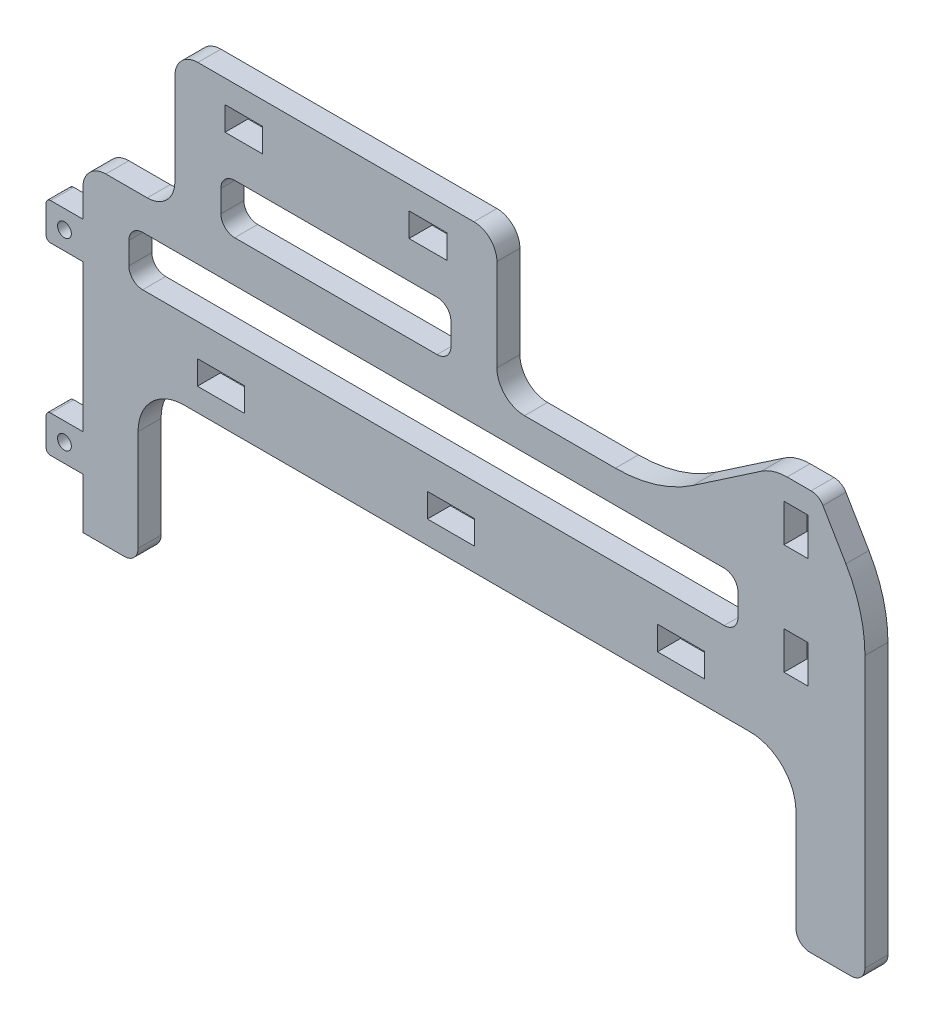
from build123d import *

# Parameters (mm, degrees)
SALIENTE_EXTRUIR1_DEPTH = 5
CROQUIS2_W              = 143
CROQUIS2_H              = 35
CORTAR_EXTRUIR1_DEPTH   = 5
REDONDEO1_R             = 10
CROQUIS3_W              = 5
CROQUIS3_H              = 8
SALIENTE_EXTRUIR2_DEPTH = 8
REDONDEO2_R             = 30
REDONDEO3_R             = 3
CROQUIS4_W              = 5.2
CROQUIS4_H              = 8.2
CORTAR_EXTRUIR2_DEPTH   = 192.034028382
REDONDEO4_R             = 3
REDONDEO5_R             = 10
REDONDEO6_R             = 1
CROQUIS5_R              = 1.5
CORTAR_EXTRUIR3_DEPTH   = 5
CROQUIS6_W              = 10.2
CROQUIS6_H              = 5.2
CORTAR_EXTRUIR4_DEPTH   = 5
CROQUIS7_W              = 132.4
CROQUIS7_H              = 10.8
CORTAR_EXTRUIR5_DEPTH   = 5
REDONDEO8_R             = 3
CROQUIS8_W              = 70
CROQUIS8_H              = 31
SALIENTE_EXTRUIR3_DEPTH = 5
CROQUIS9_W              = 8.2
CROQUIS9_H              = 5.2
CORTAR_EXTRUIR6_DEPTH   = 5
CROQUIS10_W             = 50
CROQUIS10_H             = 10.8
CORTAR_EXTRUIR7_DEPTH   = 5
REDONDEO9_R             = 3
REDONDEO10_R            = 6
REDONDEO11_R            = 5
REDONDEO12_R            = 5


with BuildPart() as part:
    # Croquis1 → Saliente-Extruir1 (new body)
    with BuildSketch(Plane.XY):
        Polygon((0, 0), (0, 70), (125, 70), (150, 87), (160, 87), (170, 70), (170, 0), align=None)
    extrude(amount=SALIENTE_EXTRUIR1_DEPTH)

    # Croquis2 → Cortar-Extruir1 (cut)
    with BuildSketch(Plane.XY.offset(5)):
        with Locations((83.5, 17.5)):
            Rectangle(CROQUIS2_W, CROQUIS2_H)
    extrude(amount=-CORTAR_EXTRUIR1_DEPTH, mode=Mode.SUBTRACT)

    # Redondeo1
    redondeo1_edges = [part.edges().sort_by_distance(p)[0] for p in [
        (12, 35, 2.5),
        (155, 35, 2.5),
    ]]
    fillet(redondeo1_edges, radius=REDONDEO1_R)

    # Croquis3 → Saliente-Extruir2 (add)
    with BuildSketch(Plane.ZY):
        with Locations((2.5, 15)):
            Rectangle(CROQUIS3_W, CROQUIS3_H)
        with Locations((2.5, 55)):
            Rectangle(CROQUIS3_W, CROQUIS3_H)
    extrude(amount=SALIENTE_EXTRUIR2_DEPTH)

    # Redondeo2
    redondeo2_edges = [part.edges().sort_by_distance(p)[0] for p in [
        (125, 70, 2.5),
        (170, 70, 2.5),
    ]]
    fillet(redondeo2_edges, radius=REDONDEO2_R)

    # Redondeo3
    redondeo3_edges = [part.edges().sort_by_distance(p)[0] for p in [
        (170, 0, 2.5),
        (12, 0, 2.5),
        (155, 0, 2.5),
    ]]
    fillet(redondeo3_edges, radius=REDONDEO3_R)

    # Croquis4 → Cortar-Extruir2 (cut, through all)
    with BuildSketch(Plane.XY.offset(5)):
        with Locations((155, 78)):
            Rectangle(CROQUIS4_W, CROQUIS4_H)
        with Locations((155, 54)):
            Rectangle(CROQUIS4_W, CROQUIS4_H)
    extrude(amount=-CORTAR_EXTRUIR2_DEPTH, mode=Mode.SUBTRACT)

    # Redondeo4
    redondeo4_edges = [part.edges().sort_by_distance(p)[0] for p in [
        (160, 87, 2.5),
    ]]
    fillet(redondeo4_edges, radius=REDONDEO4_R)

    # Redondeo5
    redondeo5_edges = [part.edges().sort_by_distance(p)[0] for p in [
        (150, 87, 2.5),
    ]]
    fillet(redondeo5_edges, radius=REDONDEO5_R)

    # Redondeo6
    redondeo6_edges = [part.edges().sort_by_distance(p)[0] for p in [
        (-8, 19, 2.5),
        (-8, 11, 2.5),
        (-8, 59, 2.5),
        (-8, 51, 2.5),
    ]]
    fillet(redondeo6_edges, radius=REDONDEO6_R)

    # Croquis5 → Cortar-Extruir3 (cut)
    with BuildSketch(Plane.XY.offset(5)):
        with Locations((-4, 55)):
            Circle(CROQUIS5_R)
        with Locations((-4, 15)):
            Circle(CROQUIS5_R)
    extrude(amount=-CORTAR_EXTRUIR3_DEPTH, mode=Mode.SUBTRACT)

    # Croquis6 → Cortar-Extruir4 (cut)
    with BuildSketch(Plane.XY.offset(5)):
        with Locations((80, 42.6)):
            Rectangle(CROQUIS6_W, CROQUIS6_H)
        with Locations((30, 42.6)):
            Rectangle(CROQUIS6_W, CROQUIS6_H)
        with Locations((130, 42.6)):
            Rectangle(CROQUIS6_W, CROQUIS6_H)
    extrude(amount=-CORTAR_EXTRUIR4_DEPTH, mode=Mode.SUBTRACT)

    # Croquis7 → Cortar-Extruir5 (cut)
    with BuildSketch(Plane.XY.offset(5)):
        with Locations((76.2, 57.6)):
            Rectangle(CROQUIS7_W, CROQUIS7_H)
    extrude(amount=-CORTAR_EXTRUIR5_DEPTH, mode=Mode.SUBTRACT)

    # Redondeo8
    redondeo8_edges = [part.edges().sort_by_distance(p)[0] for p in [
        (10, 52.2, 2.5),
        (10, 63, 2.5),
        (142.4, 63, 2.5),
        (142.4, 52.2, 2.5),
    ]]
    fillet(redondeo8_edges, radius=REDONDEO8_R)

    # Croquis8 → Saliente-Extruir3 (add)
    with BuildSketch(Plane.XY.offset(5)):
        with Locations((55, 85.5)):
            Rectangle(CROQUIS8_W, CROQUIS8_H)
    extrude(amount=-SALIENTE_EXTRUIR3_DEPTH)

    # Croquis9 → Cortar-Extruir6 (cut)
    with BuildSketch(Plane.XY.offset(5)):
        with Locations((35, 93.4)):
            Rectangle(CROQUIS9_W, CROQUIS9_H)
        with Locations((75, 93.4)):
            Rectangle(CROQUIS9_W, CROQUIS9_H)
    extrude(amount=-CORTAR_EXTRUIR6_DEPTH, mode=Mode.SUBTRACT)

    # Croquis10 → Cortar-Extruir7 (cut)
    with BuildSketch(Plane.XY.offset(5)):
        with Locations((55, 77.4)):
            Rectangle(CROQUIS10_W, CROQUIS10_H)
    extrude(amount=-CORTAR_EXTRUIR7_DEPTH, mode=Mode.SUBTRACT)

    # Redondeo9
    redondeo9_edges = [part.edges().sort_by_distance(p)[0] for p in [
        (30, 72, 2.5),
        (30, 82.8, 2.5),
        (80, 82.8, 2.5),
        (80, 72, 2.5),
    ]]
    fillet(redondeo9_edges, radius=REDONDEO9_R)

    # Redondeo10
    redondeo10_edges = [part.edges().sort_by_distance(p)[0] for p in [
        (20, 70, 2.5),
        (90, 70, 2.5),
    ]]
    fillet(redondeo10_edges, radius=REDONDEO10_R)

    # Redondeo11
    redondeo11_edges = [part.edges().sort_by_distance(p)[0] for p in [
        (20, 101, 2.5),
        (90, 101, 2.5),
    ]]
    fillet(redondeo11_edges, radius=REDONDEO11_R)

    # Redondeo12
    redondeo12_edges = [part.edges().sort_by_distance(p)[0] for p in [
        (0, 70, 2.5),
    ]]
    fillet(redondeo12_edges, radius=REDONDEO12_R)


solid = part.part
